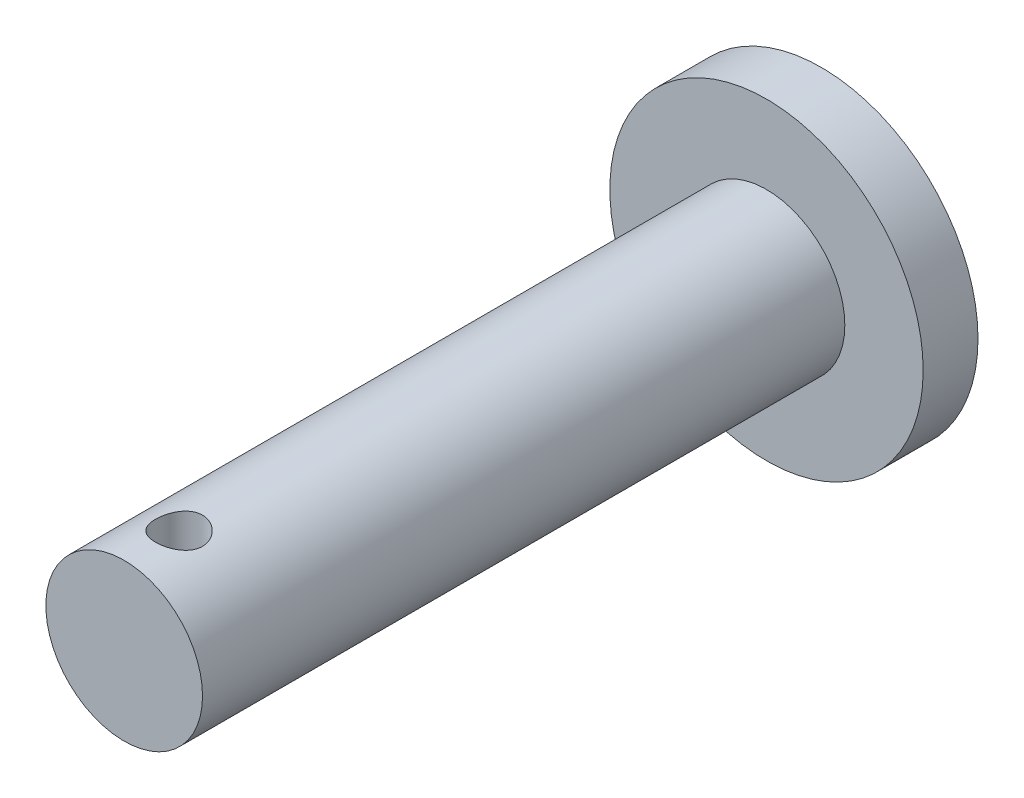
from build123d import *

# Parameters (mm, degrees)
IZIM1_R                     = 20
Y_KSEKLIK_EKSTR_ZYON1_DEPTH = 7
IZIM2_R                     = 10
Y_KSEKLIK_EKSTR_ZYON2_DEPTH = 82
IZIM3_R                     = 3
KES_EKSTR_ZYON1_DEPTH       = 41


with BuildPart() as part:
    # Çizim1 → Yükseklik-Ekstrüzyon1 (new body)
    with BuildSketch(Plane.XY):
        Circle(IZIM1_R)
    extrude(amount=Y_KSEKLIK_EKSTR_ZYON1_DEPTH)

    # Çizim2 → Yükseklik-Ekstrüzyon2 (add)
    with BuildSketch(Plane.XY.offset(7)):
        Circle(IZIM2_R)
    extrude(amount=Y_KSEKLIK_EKSTR_ZYON2_DEPTH)

    # Çizim3 → Kes-Ekstrüzyon1 (cut, symmetric)
    with BuildSketch(Plane(origin=(0, 0, 0), x_dir=(1, 0, 0), z_dir=(0, 1, 0))):
        with Locations(Location((0, -82, 0), (0, 0, 270))):
            Circle(IZIM3_R)
    extrude(amount=KES_EKSTR_ZYON1_DEPTH, both=True, mode=Mode.SUBTRACT)


solid = part.part
